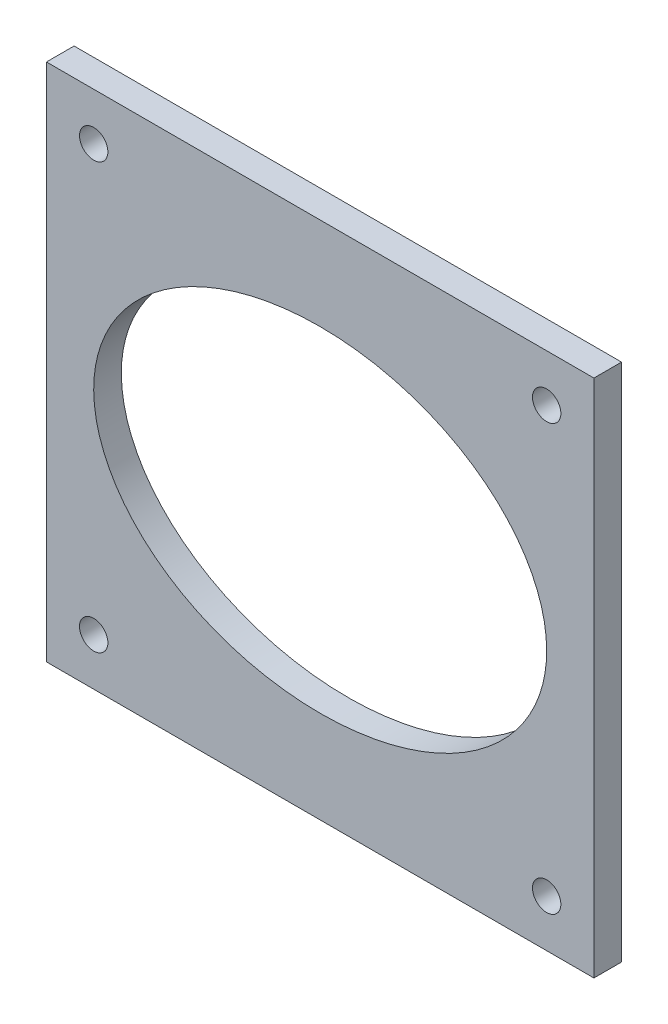
from build123d import *

# Parameters (mm, degrees)
SKETCH1_W           = 115.9
SKETCH1_H           = 110
SKETCH1_R           = 3
SKETCH1_RX          = 47.95
SKETCH1_RY          = 35.45
BOSS_EXTRUDE1_DEPTH = 5.85


with BuildPart() as part:
    # Sketch1 → Boss-Extrude1 (new body)
    with BuildSketch(Plane.XY):
        Rectangle(SKETCH1_W, SKETCH1_H)
        with Locations((-47.95, 45)):
            Circle(SKETCH1_R, mode=Mode.SUBTRACT)
        with Locations((-47.95, -45)):
            Circle(SKETCH1_R, mode=Mode.SUBTRACT)
        with Locations((47.95, -45)):
            Circle(SKETCH1_R, mode=Mode.SUBTRACT)
        with Locations((47.95, 45)):
            Circle(SKETCH1_R, mode=Mode.SUBTRACT)
        with Locations((0, 0)):
            Ellipse(SKETCH1_RX, SKETCH1_RY, mode=Mode.SUBTRACT)
    extrude(amount=BOSS_EXTRUDE1_DEPTH)


solid = part.part
